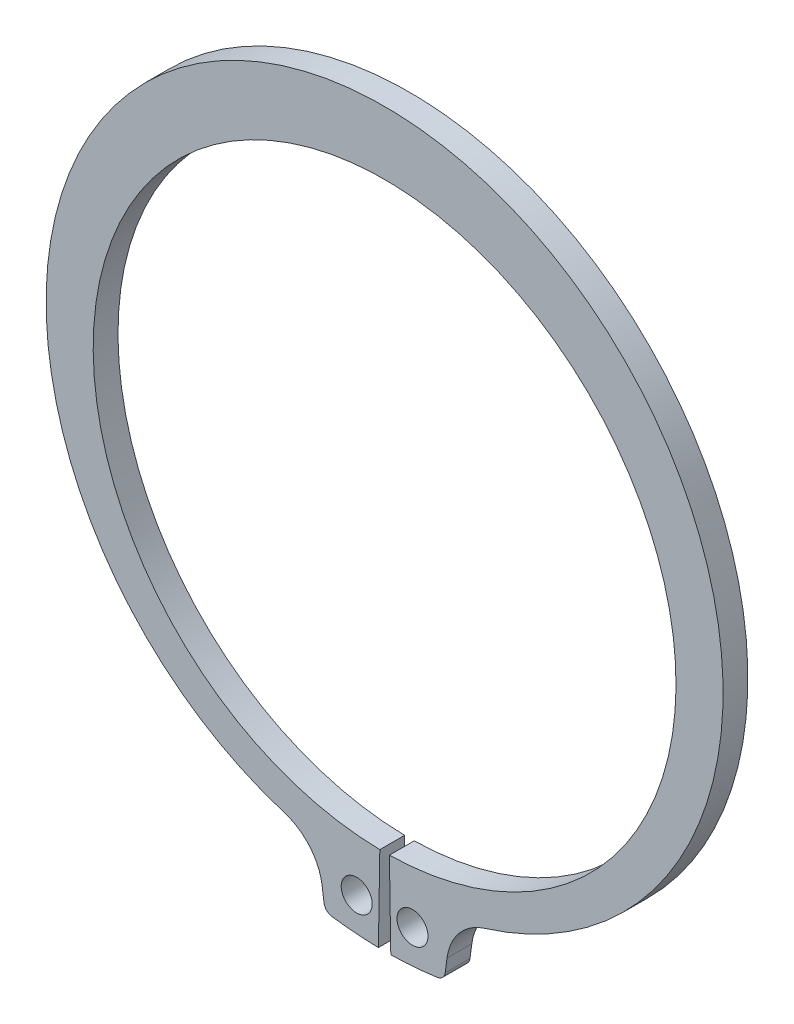
from build123d import *

# Parameters (mm, degrees)
BODYSKE_R  = 1.25
BODY_DEPTH = 2


with BuildPart() as part:
    # BodySke → Body (new body)
    with BuildSketch(Plane.XY):
        with BuildLine():
            Line((0.386513158, -23.496821223), (0.5, -30.39588788))
            ThreePointArc((0.5, -30.39588788), (2.379442525, -30.306736104), (4.249769934, -30.101485935))
            ThreePointArc((4.249769934, -30.101485935), (4.677728464, -29.886694333), (4.888507282, -29.456745236))
            Line((4.888507282, -29.456745236), (5.032868407, -28.360213631))
            ThreePointArc((5.032868407, -28.360213631), (6.021169182, -26.1226958), (8.06072845, -24.772354193))
            ThreePointArc((8.06072845, -24.772354193), (0, 28.6), (-8.06072845, -24.772354193))
            ThreePointArc((-8.06072845, -24.772354193), (-6.021169182, -26.1226958), (-5.032868407, -28.360213631))
            Line((-5.032868407, -28.360213631), (-4.888507282, -29.456745236))
            ThreePointArc((-4.888507282, -29.456745236), (-4.677728464, -29.886694333), (-4.249769934, -30.101485935))
            ThreePointArc((-4.249769934, -30.101485935), (-2.379442525, -30.306736104), (-0.5, -30.39588788))
            Line((-0.5, -30.39588788), (-0.386513158, -23.496821223))
            ThreePointArc((-0.386513158, -23.496821223), (0, 23.5), (0.386513158, -23.496821223))
        make_face()
        with Locations((2.25, -27.608467904)):
            Circle(BODYSKE_R, mode=Mode.SUBTRACT)
        with Locations((-2.25, -27.608467904)):
            Circle(BODYSKE_R, mode=Mode.SUBTRACT)
    extrude(amount=-BODY_DEPTH)


solid = part.part
